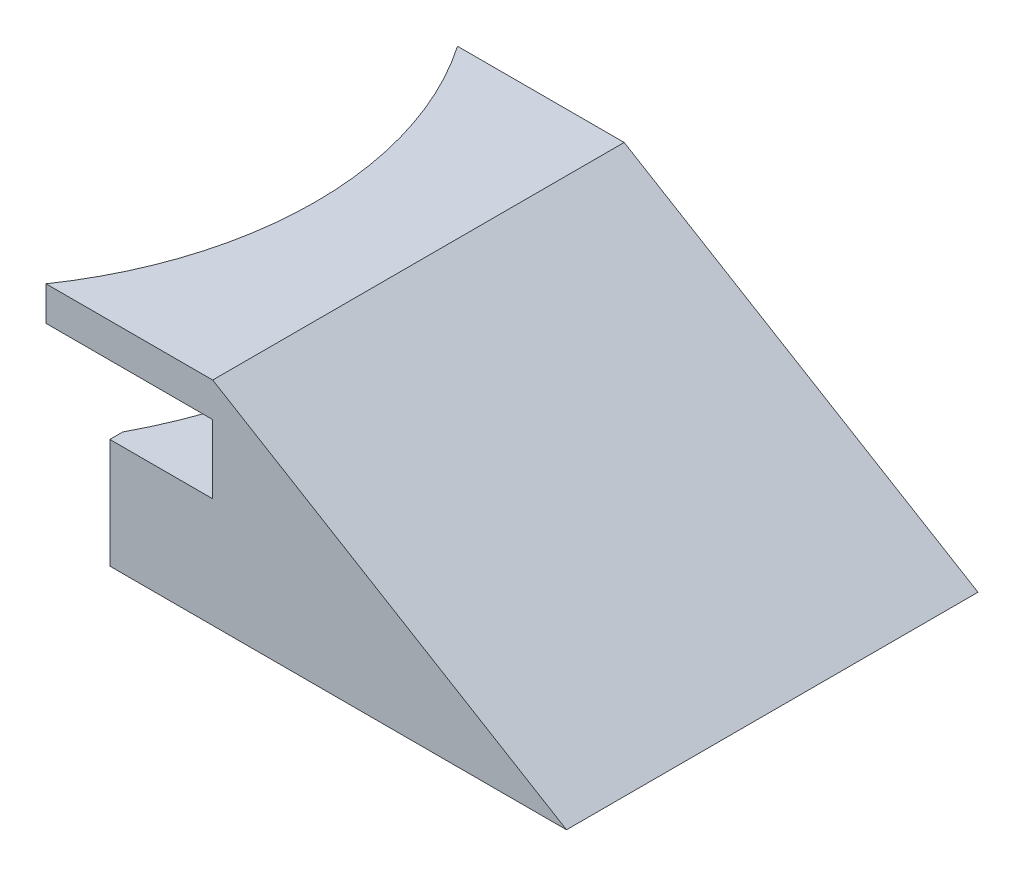
from build123d import *

# Parameters (mm, degrees)
ESTRUSIONE_ESTRUSIONE1_DEPTH = 60
SCHIZZO2_R                   = 53
TAGLIO_ESTRUSIONE1_DEPTH     = 60
SCHIZZO3_R                   = 60
TAGLIO_ESTRUSIONE2_DEPTH     = 21


with BuildPart() as part:
    # Schizzo1 → Estrusione-Estrusione1 (new body)
    with BuildSketch(Plane.XY):
        Polygon((-65, 26), (0, 26), (0, 16), (-15, 16), (-15, 0), (51.592663953, 0), (0, 31), (-65, 31), align=None)
    extrude(amount=ESTRUSIONE_ESTRUSIONE1_DEPTH)

    # Schizzo2 → Taglio-Estrusione1 (cut)
    with BuildSketch(Plane(origin=(0, 31, 0), x_dir=(1, 0, 0), z_dir=(0, 1, 0))):
        with Locations((-68, -30)):
            Circle(SCHIZZO2_R)
    extrude(amount=-TAGLIO_ESTRUSIONE1_DEPTH, mode=Mode.SUBTRACT)

    # Schizzo3 → Taglio-Estrusione2 (cut)
    with BuildSketch(Plane.XZ):
        with Locations((-68, 30)):
            Circle(SCHIZZO3_R)
    extrude(amount=-TAGLIO_ESTRUSIONE2_DEPTH, mode=Mode.SUBTRACT)


solid = part.part
